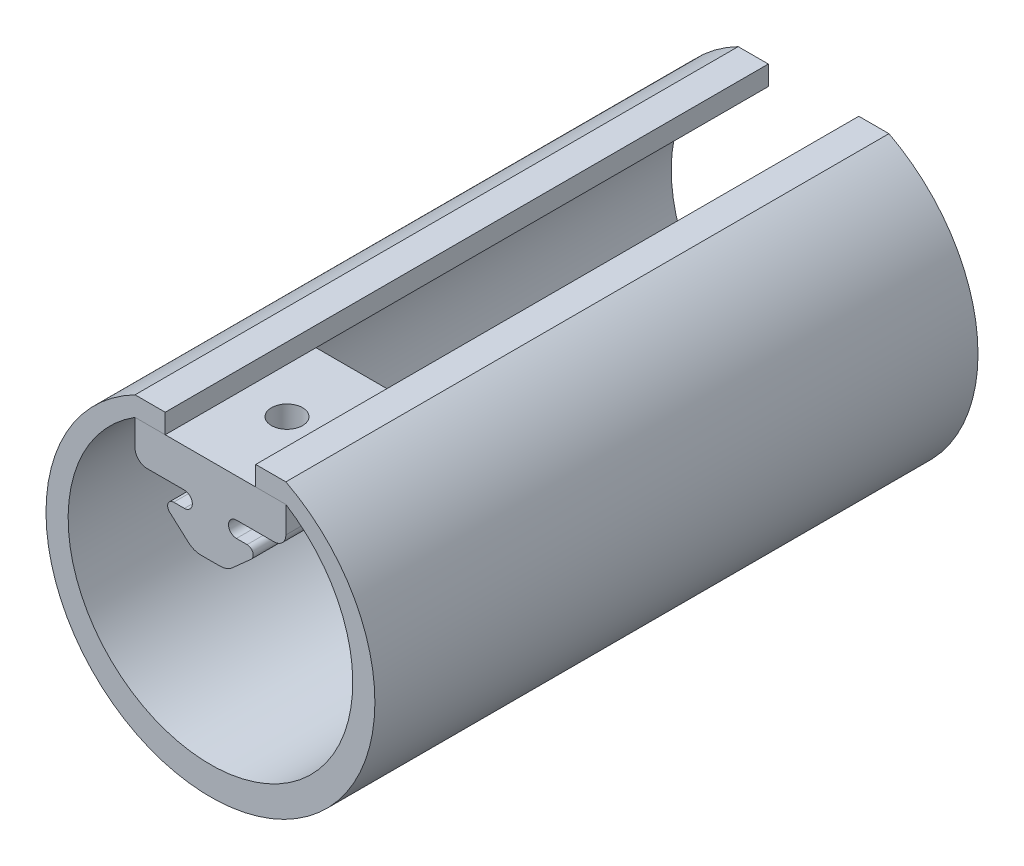
from build123d import *

# Parameters (mm, degrees)
EXTRUDE1_DEPTH      = 25
SKETCH2_R           = 2.5796875
CUT_EXTRUDE1_DEPTH  = 32.407601389
SKETCH5_W           = 5
SKETCH5_H           = 3.237358095
BOSS_EXTRUDE1_DEPTH = 100


with BuildPart() as part:
    # Sketch1 → Extrude1 (new body)
    with BuildSketch(Plane.XY):
        with BuildLine():
            Line((4.315, 12.745), (10.532068835, 12.745))
            ThreePointArc((10.532068835, 12.745), (11.926539753, 13.316381695), (12.505, 14.707931165))
            Line((12.505, 14.707931165), (12.505, 19.095))
            Line((12.505, 19.095), (-12.495, 19.095))
            Line((-12.495, 19.095), (-12.495, 14.707931165))
            ThreePointArc((-12.495, 14.707931165), (-11.920070773, 13.319929227), (-10.532068835, 12.745))
            Line((-10.532068835, 12.745), (-4.315, 12.745))
            ThreePointArc((-4.315, 12.745), (-3, 11.43), (-4.315, 10.115))
            Line((-4.315, 10.115), (-6.085, 10.115))
            ThreePointArc((-6.085, 10.115), (-7.028446777, 9.465566469), (-6.758614403, 8.352441938))
            Line((-6.758614403, 8.352441938), (-3.664622209, 5.583010835))
            ThreePointArc((-3.664622209, 5.583010835), (-2.682085626, 4.983884868), (-1.550406707, 4.775))
            Line((-1.550406707, 4.775), (1.550406707, 4.775))
            ThreePointArc((1.550406707, 4.775), (2.682085626, 4.983884868), (3.664622209, 5.583010835))
            Line((3.664622209, 5.583010835), (6.758614403, 8.352441938))
            ThreePointArc((6.758614403, 8.352441938), (7.028446777, 9.465566469), (6.085, 10.115))
            Line((6.085, 10.115), (4.315, 10.115))
            ThreePointArc((4.315, 10.115), (3, 11.43), (4.315, 12.745))
        make_face()
    extrude(amount=-EXTRUDE1_DEPTH)

    # Sketch2 → Cut-Extrude1 (cut, through all)
    with BuildSketch(Plane(origin=(0, 19.095, 0), x_dir=(1, 0, 0), z_dir=(0, 1, 0))):
        with Locations(Location((0, 12.7, 0), (0, 0, 126.94195449))):
            Circle(SKETCH2_R)
    extrude(amount=-CUT_EXTRUDE1_DEPTH, mode=Mode.SUBTRACT)


with BuildPart() as body_2:
    # Sketch5 → Boss-Extrude1 (new body)
    with BuildSketch(Plane.XY):
        with BuildLine():
            Line((-12.495, 19.095), (-12.495, 22.332358095))
            ThreePointArc((-12.495, 22.332358095), (0.005, -29.167686251), (12.505, 22.332358095))
            Line((12.505, 22.332358095), (12.505, 19.095))
            ThreePointArc((12.505, 19.095), (0.005, -24.517190702), (-12.495, 19.095))
        make_face()
        with Locations((-9.995, 20.713679048)):
            Rectangle(SKETCH5_W, SKETCH5_H)
        with Locations((10.005, 20.713679048)):
            Rectangle(SKETCH5_W, SKETCH5_H)
    extrude(amount=-BOSS_EXTRUDE1_DEPTH)


solid = Compound([part.part, body_2.part])
